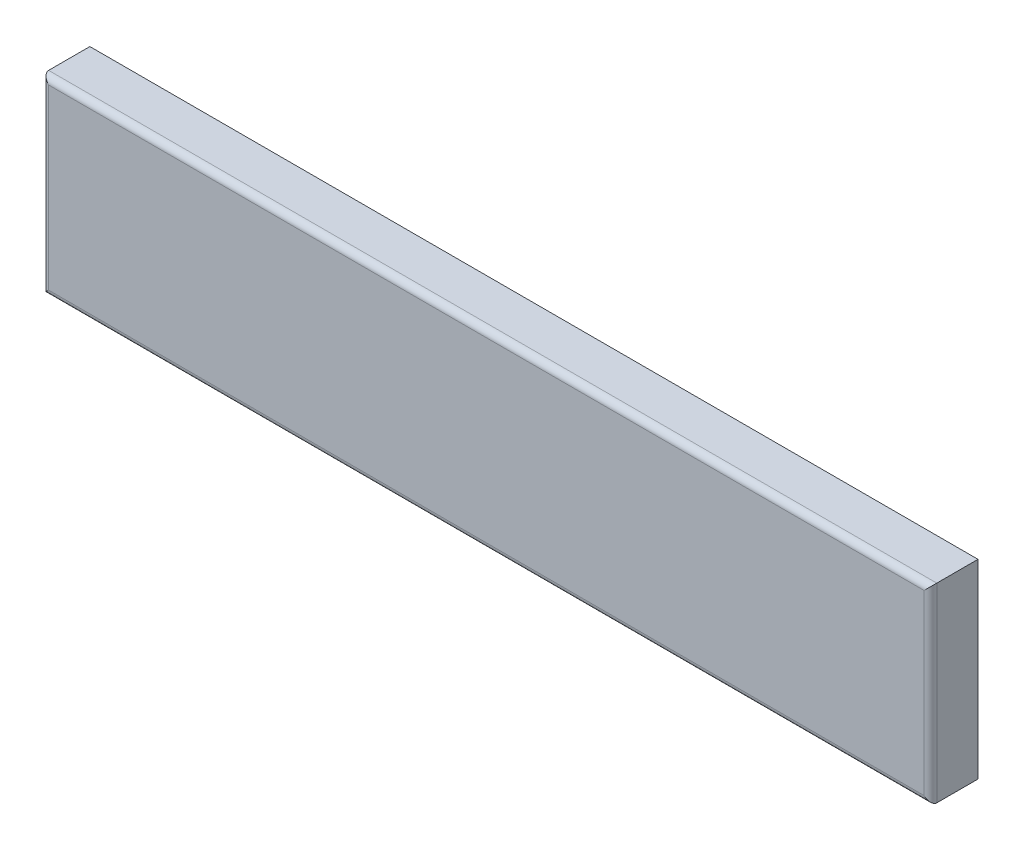
from build123d import *

# Parameters (mm, degrees)
SKETCH1_W           = 355.6
SKETCH1_H           = 76.2
BOSS_EXTRUDE1_DEPTH = 2.54
SKETCH2_W           = 355.6
SKETCH2_H           = 76.2
SKETCH2_W_2         = 350.52
SKETCH2_H_2         = 71.12
BOSS_EXTRUDE2_DEPTH = 19.05
FILLET1_R           = 2.54


with BuildPart() as part:
    # Sketch1 → Boss-Extrude1 (new body)
    with BuildSketch(Plane.XY):
        Rectangle(SKETCH1_W, SKETCH1_H)
    extrude(amount=BOSS_EXTRUDE1_DEPTH)

    # Sketch2 → Boss-Extrude2 (add)
    with BuildSketch(Plane.XY.offset(2.54)):
        Rectangle(SKETCH2_W, SKETCH2_H)
        Rectangle(SKETCH2_W_2, SKETCH2_H_2, mode=Mode.SUBTRACT)
    extrude(amount=-BOSS_EXTRUDE2_DEPTH)

    # Fillet1
    fillet1_edges = [part.edges().sort_by_distance(p)[0] for p in [
        (-177.8, 0, 2.54),
        (0, -38.1, 2.54),
        (177.8, 0, 2.54),
        (0, 38.1, 2.54),
    ]]
    fillet(fillet1_edges, radius=FILLET1_R)


solid = part.part
